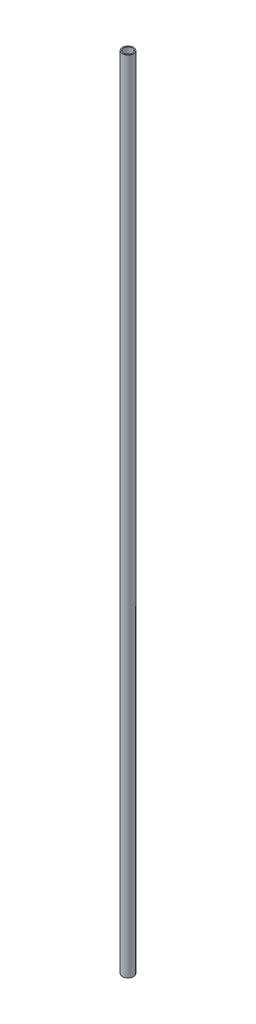
from build123d import *

# Parameters (mm, degrees)
SKETCH1_R           = 6.35
SKETCH1_R_2         = 5.1054
BOSS_EXTRUDE1_DEPTH = 914.4


with BuildPart() as part:
    # Sketch1 → Boss-Extrude1 (new body)
    with BuildSketch(Plane(origin=(0, 0, 0), x_dir=(1, 0, 0), z_dir=(0, 1, 0))):
        with Locations(Location((0, 0, 0), (0, 0, 90))):
            Circle(SKETCH1_R)
        with Locations(Location((0, 0, 0), (0, 0, 90))):
            Circle(SKETCH1_R_2, mode=Mode.SUBTRACT)
    extrude(amount=BOSS_EXTRUDE1_DEPTH)


solid = part.part
